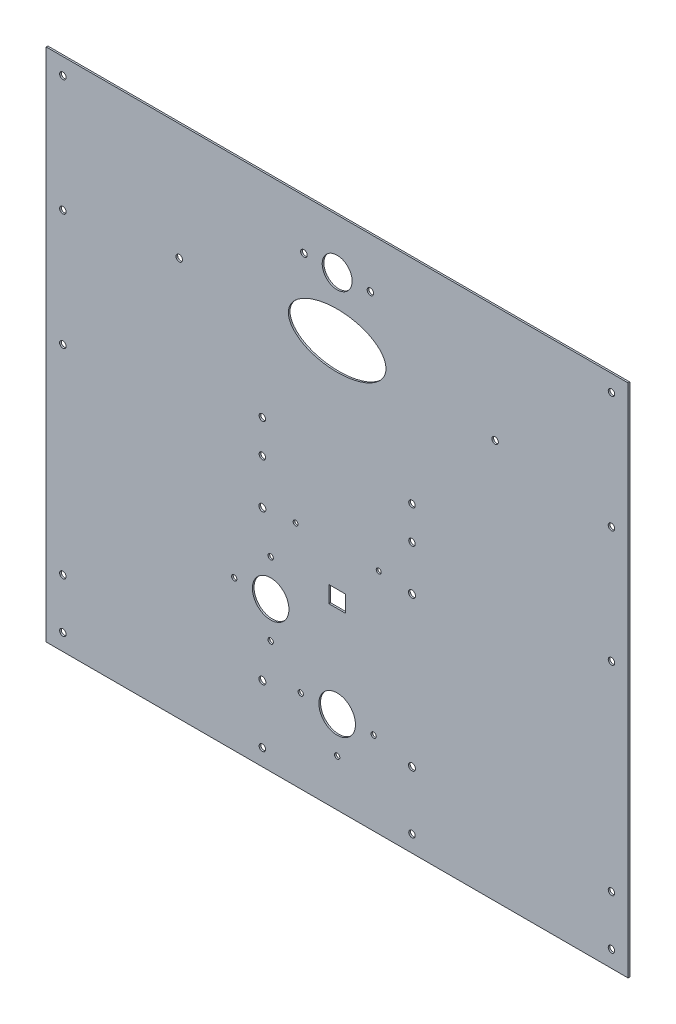
from build123d import *

# Parameters (mm, degrees)
SKETCH_1_W          = 350
SKETCH_1_H          = 310
SKETCH_1_R          = 1.95
SKETCH_1_R_2        = 9
EXTRUDE_1_DEPTH     = 1
SKETCH_2_R          = 2.1
SKETCH_2_R_2        = 1.6
SKETCH_2_R_3        = 11
SKETCH_2_R_4        = 1.5
SKETCH_2_W          = 10
SKETCH_2_H          = 10
CUT_EXTRUDE_1_DEPTH = 10
SKETCH_3_RX         = 29.354112179
SKETCH_3_RY         = 16.489205711
CUT_EXTRUDE_2_DEPTH = 8


with BuildPart() as part:
    # 草图1 → 凸台-拉伸1 (new body)
    with BuildSketch(Plane.XY):
        with Locations((175, 155)):
            Rectangle(SKETCH_1_W, SKETCH_1_H)
        with Locations((10, 300)):
            Circle(SKETCH_1_R, mode=Mode.SUBTRACT)
        with Locations((10, 230)):
            Circle(SKETCH_1_R, mode=Mode.SUBTRACT)
        with Locations((10, 40)):
            Circle(SKETCH_1_R, mode=Mode.SUBTRACT)
        with Locations((10, 10)):
            Circle(SKETCH_1_R, mode=Mode.SUBTRACT)
        with Locations((340, 300)):
            Circle(SKETCH_1_R, mode=Mode.SUBTRACT)
        with Locations((340, 230)):
            Circle(SKETCH_1_R, mode=Mode.SUBTRACT)
        with Locations((340, 40)):
            Circle(SKETCH_1_R, mode=Mode.SUBTRACT)
        with Locations((340, 10)):
            Circle(SKETCH_1_R, mode=Mode.SUBTRACT)
        with Locations((130, 10)):
            Circle(SKETCH_1_R, mode=Mode.SUBTRACT)
        with Locations((220, 10)):
            Circle(SKETCH_1_R, mode=Mode.SUBTRACT)
        with Locations((10, 160)):
            Circle(SKETCH_1_R, mode=Mode.SUBTRACT)
        with Locations((340, 160)):
            Circle(SKETCH_1_R, mode=Mode.SUBTRACT)
        with Locations((130, 162)):
            Circle(SKETCH_1_R, mode=Mode.SUBTRACT)
        with Locations((220, 162)):
            Circle(SKETCH_1_R, mode=Mode.SUBTRACT)
        with Locations((175, 280)):
            Circle(SKETCH_1_R_2, mode=Mode.SUBTRACT)
        with Locations((130, 182)):
            Circle(SKETCH_1_R, mode=Mode.SUBTRACT)
        with Locations((220, 182)):
            Circle(SKETCH_1_R, mode=Mode.SUBTRACT)
        with Locations((80, 240)):
            Circle(SKETCH_1_R, mode=Mode.SUBTRACT)
        with Locations((270, 240)):
            Circle(SKETCH_1_R, mode=Mode.SUBTRACT)
        with Locations((155, 280)):
            Circle(SKETCH_1_R, mode=Mode.SUBTRACT)
        with Locations((195, 280)):
            Circle(SKETCH_1_R, mode=Mode.SUBTRACT)
    extrude(amount=EXTRUDE_1_DEPTH)

    # 草图2 → 切除-拉伸1 (cut)
    with BuildSketch(Plane(origin=(0, 0, 0), x_dir=(-1, 0, 0), z_dir=(0, 0, -1))):
        with Locations((-130, 135)):
            Circle(SKETCH_2_R)
        with Locations((-220, 45)):
            Circle(SKETCH_2_R)
        with Locations((-220, 135)):
            Circle(SKETCH_2_R)
        with Locations((-130, 45)):
            Circle(SKETCH_2_R)
        with Locations((-153.079689783, 50)):
            Circle(SKETCH_2_R_2)
        with Locations((-175, 28.079689783)):
            Circle(SKETCH_2_R_2)
        with Locations((-196.920310217, 50)):
            Circle(SKETCH_2_R_2)
        with Locations((-175, 50)):
            Circle(SKETCH_2_R_3)
        with Locations((-150, 137)):
            Circle(SKETCH_2_R_4)
        with Locations((-135, 90)):
            Circle(SKETCH_2_R_3)
        with Locations((-200, 137)):
            Circle(SKETCH_2_R_4)
        with Locations((-113.079689783, 90)):
            Circle(SKETCH_2_R_2)
        with Locations((-135, 68.079689783)):
            Circle(SKETCH_2_R_2)
        with Locations((-135, 111.920310217)):
            Circle(SKETCH_2_R_2)
        with Locations((-175, 110)):
            Rectangle(SKETCH_2_W, SKETCH_2_H)
    extrude(amount=-CUT_EXTRUDE_1_DEPTH, mode=Mode.SUBTRACT)

    # 草图3 → 切除-拉伸2 (cut)
    with BuildSketch(Plane.XY.offset(1)):
        with Locations((175, 244.534964975)):
            Ellipse(SKETCH_3_RX, SKETCH_3_RY)
    extrude(amount=-CUT_EXTRUDE_2_DEPTH, mode=Mode.SUBTRACT)


solid = part.part
